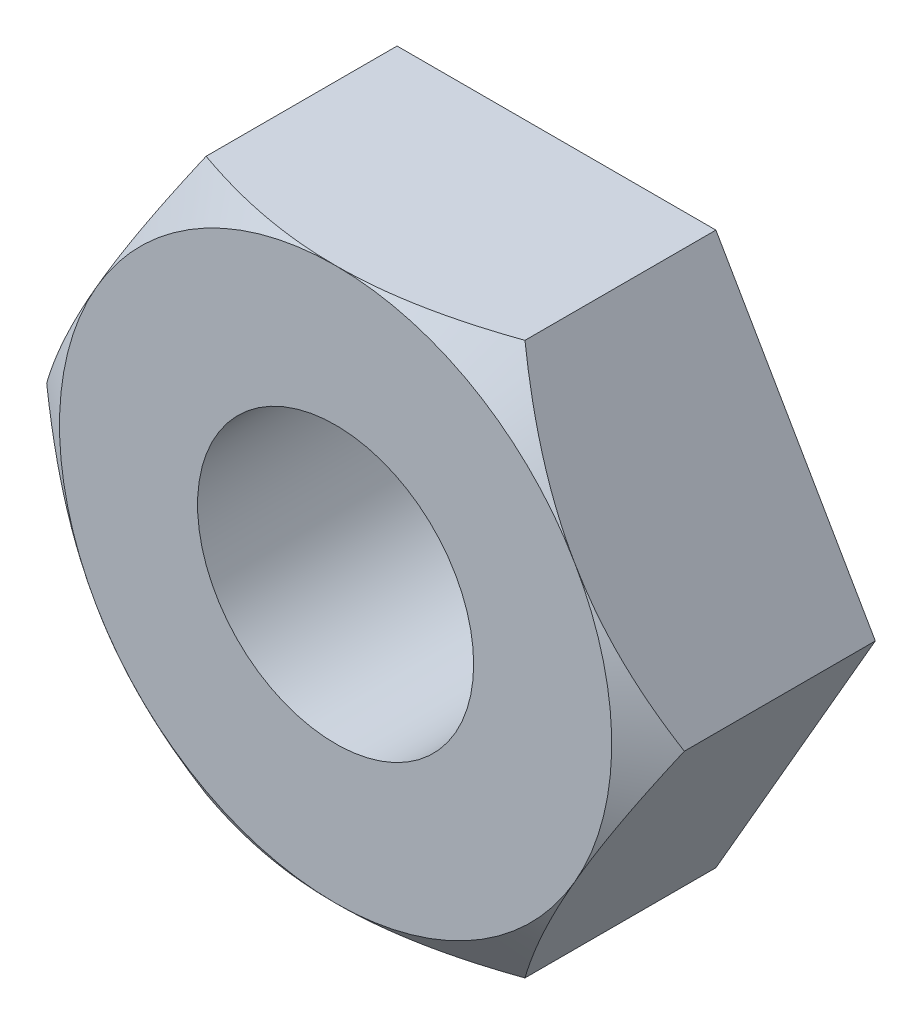
from build123d import *

# Parameters (mm, degrees)
SKETCH_2_R          = 1
EXTRUDE_1_DEPTH     = 0.8
CUT_EXTRUDE_START   = 0.8
SKETCH_4_R          = 2.618802154
SKETCH_4_R_2        = 2
CUT_EXTRUDE_1_DEPTH = 1
CUT_EXTRUDE_1_DRAFT = -55


with BuildPart() as part:
    # 草图2 → 凸台-拉伸1 (new, symmetric)
    with BuildSketch(Plane.XY):
        Polygon((1.154700538, 2), (-1.154700538, 2), (-2.309401077, 0), (-1.154700538, -2), (1.154700538, -2), (2.309401077, 0), align=None)
        Circle(SKETCH_2_R, mode=Mode.SUBTRACT)
    extrude(amount=EXTRUDE_1_DEPTH, both=True)


with BuildPart() as cut_extrude_1_tool:
    # 草图4 → 切除-拉伸1 (with draft: the straight prism first)
    with BuildSketch(Plane.XY.offset(CUT_EXTRUDE_START)):
        Circle(SKETCH_4_R)
        Circle(SKETCH_4_R_2, mode=Mode.SUBTRACT)
    extrude(amount=-CUT_EXTRUDE_1_DEPTH)
    # 切除-拉伸1: the draft: its side faces are tilted about the plane it starts from
    cut_extrude_1_sides = [cut_extrude_1_tool.faces().sort_by_distance(p)[0] for p in [
        (-2.618802154, 0, 0.3),
        (-2, 0, 0.3),
    ]]
    draft(cut_extrude_1_sides, Plane.XY.offset(CUT_EXTRUDE_START), CUT_EXTRUDE_1_DRAFT)


with BuildPart() as part_1:
    add(part.part)

    # 切除-拉伸1: cut by cut_extrude_1_tool
    add(cut_extrude_1_tool.part, mode=Mode.SUBTRACT)


solid = part_1.part
